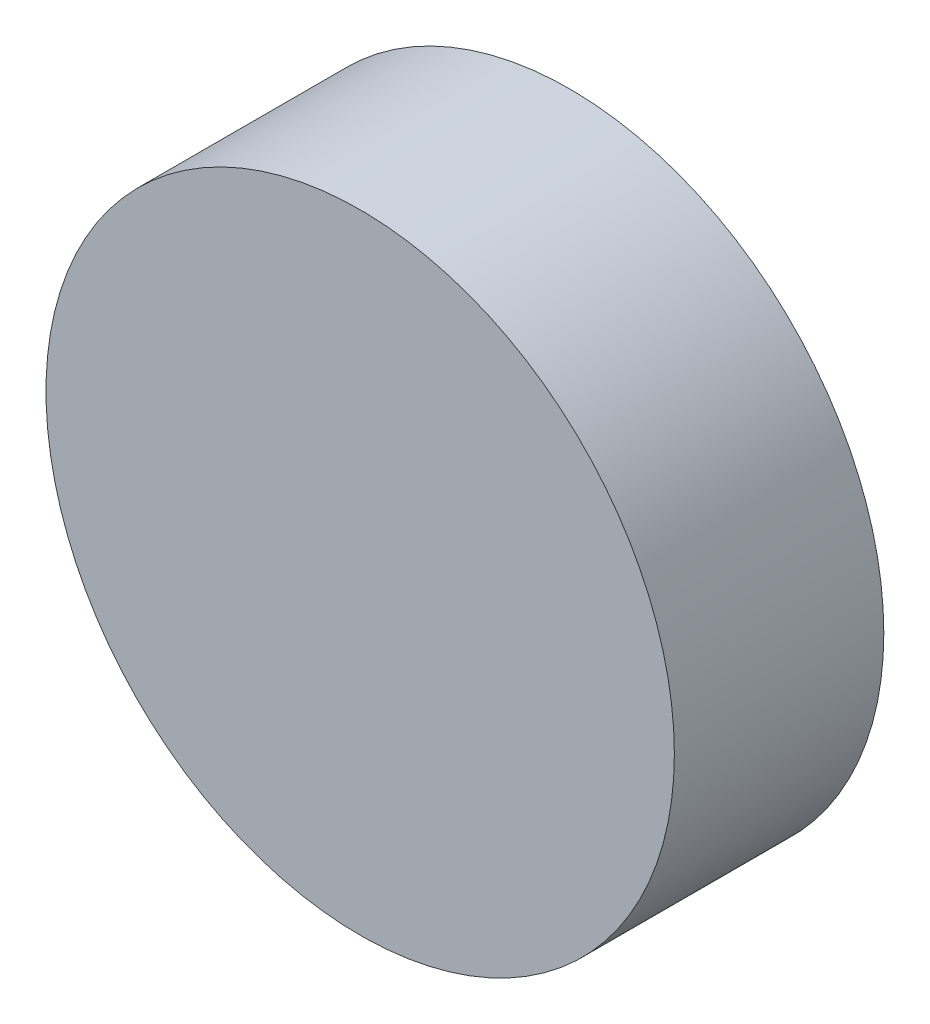
from build123d import *

# Parameters (mm, degrees)
DIAMETRIC_MAGNET_D6_L2_START     = -18.8
DIAMETRIC_MAGNET_D6_L2_PROFILE_R = 3
DIAMETRIC_MAGNET_D6_L2_DEPTH     = 2


with BuildPart() as part:
    # Diametric_magnet_D6_L2_Profile → Diametric_magnet_D6_L2 (new body)
    with BuildSketch(Plane.XY.offset(DIAMETRIC_MAGNET_D6_L2_START)):
        with Locations((12.5, 0)):
            Circle(DIAMETRIC_MAGNET_D6_L2_PROFILE_R)
    extrude(amount=DIAMETRIC_MAGNET_D6_L2_DEPTH)


solid = part.part
